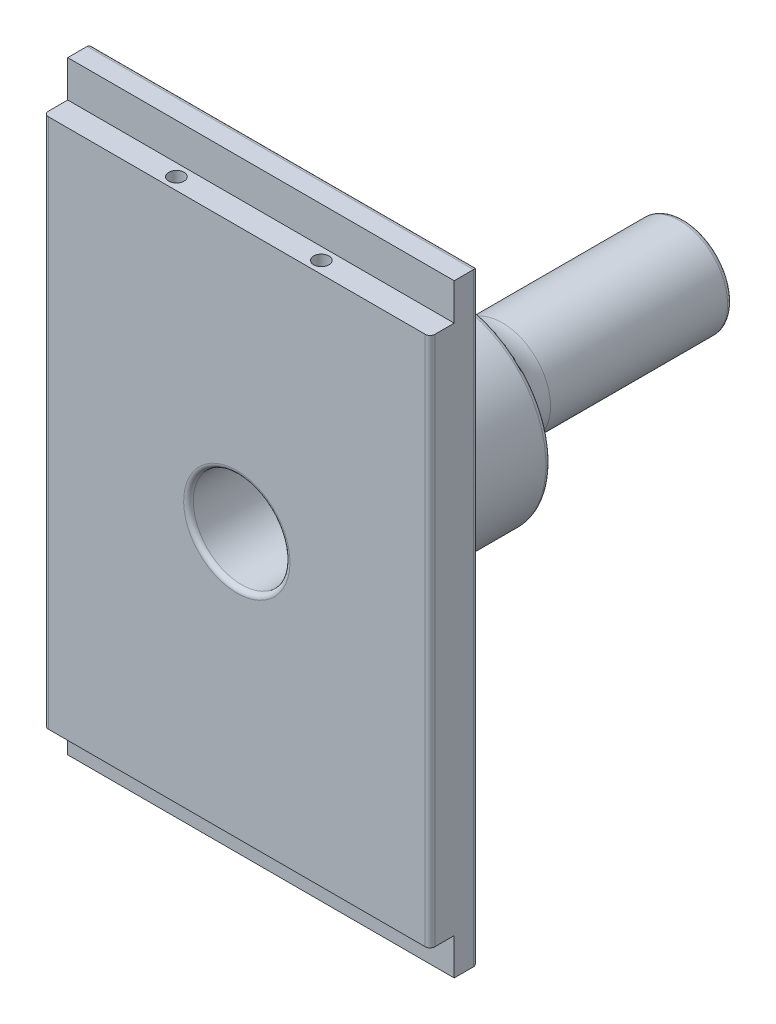
from build123d import *

# Parameters (mm, degrees)
BOSS_EXTRUDE1_DEPTH                  = 50.8
BOSS_EXTRUDE1_DEPTH_BACK             = 50.8
F_10_32_TAPPED_HOLE1_D               = 4.0386
F_10_32_TAPPED_HOLE1_DEPTH           = 25.4
F_10_32_TAPPED_HOLE1_TIP             = 1.213317848
F_10_32_TAPPED_HOLE1_ON_FACE_2_D     = 4.0386
F_10_32_TAPPED_HOLE1_ON_FACE_2_DEPTH = 25.4
F_10_32_TAPPED_HOLE1_ON_FACE_2_TIP   = 1.213317848
SKETCH3_R                            = 25.4
BOSS_EXTRUDE2_DEPTH                  = 44.45
SKETCH4_R                            = 12.7
BOSS_EXTRUDE3_DEPTH                  = 60.452
FILLET1_R                            = 1.27
FILLET2_R                            = 12.7
BODY_MOVE_COPY1_ANGLE                = 90


with BuildPart() as part:
    # Sketch1 → Boss-Extrude1 (new, two sides: drawn at the far end of the back side and taken through both)
    with BuildSketch(Plane(origin=(0, 0, 0), x_dir=(1, 0, 0), z_dir=(0, 1, 0)).offset(-BOSS_EXTRUDE1_DEPTH_BACK)):
        Polygon((0, -50.8), (-79.375, -50.8), (-79.375, -57.15), (-69.723, -57.15), (-69.723, -63.5), (69.723, -63.5), (69.723, -57.15), (79.375, -57.15), (79.375, -50.8), align=None)
    extrude(amount=BOSS_EXTRUDE1_DEPTH + BOSS_EXTRUDE1_DEPTH_BACK)

    # #10-32 Tapped Hole1
    with Locations(Plane(origin=(-69.723, 19.05, 60.325), x_dir=(0, 0, -1), z_dir=(-1, 0, 0))):
        with Locations((0, 0), (0, 38.1)):
            Hole(F_10_32_TAPPED_HOLE1_D / 2, depth=F_10_32_TAPPED_HOLE1_DEPTH)
            with Locations((0, 0, -(F_10_32_TAPPED_HOLE1_DEPTH + F_10_32_TAPPED_HOLE1_TIP / 2))):  # 118° drill point
                Cone(0, F_10_32_TAPPED_HOLE1_D / 2, F_10_32_TAPPED_HOLE1_TIP, mode=Mode.SUBTRACT)

    # #10-32 Tapped Hole1 on face 2
    with Locations(Plane(origin=(69.723, 19.05, 60.325), x_dir=(0, 0, 1), z_dir=(1, 0, 0))):
        with Locations((0, 0), (0, 38.1)):
            Hole(F_10_32_TAPPED_HOLE1_ON_FACE_2_D / 2, depth=F_10_32_TAPPED_HOLE1_ON_FACE_2_DEPTH)
            with Locations((0, 0, -(F_10_32_TAPPED_HOLE1_ON_FACE_2_DEPTH + F_10_32_TAPPED_HOLE1_ON_FACE_2_TIP / 2))):  # 118° drill point
                Cone(0, F_10_32_TAPPED_HOLE1_ON_FACE_2_D / 2, F_10_32_TAPPED_HOLE1_ON_FACE_2_TIP, mode=Mode.SUBTRACT)

    # Sketch3 → Boss-Extrude2 (add)
    with BuildSketch(Plane(origin=(0, 0, 50.8), x_dir=(-1, 0, 0), z_dir=(0, 0, -1))):
        Circle(SKETCH3_R)
    extrude(amount=BOSS_EXTRUDE2_DEPTH)

    # Sketch4 → Boss-Extrude3 (add)
    with BuildSketch(Plane(origin=(0, 0, 6.35), x_dir=(-1, 0, 0), z_dir=(0, 0, -1))):
        Circle(SKETCH4_R)
    extrude(amount=BOSS_EXTRUDE3_DEPTH)

    # Sketch5 → 1/4 (0.25) Diameter Hole1 (revolve, cut)
    with BuildSketch(Plane(origin=(0, 0, -54.102), x_dir=(0, 1, 0), z_dir=(1, 0, 0))):
        Polygon((0, 0), (0, 27.307732465), (3.175, 25.4), (3.175, 0), align=None)
    revolve(axis=Axis((0, 0, -60.452), (0, 0, 1)), mode=Mode.SUBTRACT)

    # Sketch6 → 1 (1) Diameter Hole1 (revolve, cut)
    with BuildSketch(Plane(origin=(0, 0, 63.5), x_dir=(0, -1, 0), z_dir=(1, 0, 0))):
        Polygon((0, 0), (0, 58.430929862), (12.7, 50.8), (12.7, 0), align=None)
    revolve(axis=Axis((0, 0, 69.85), (0, 0, -1)), mode=Mode.SUBTRACT)

    # Fillet1
    fillet1_edges = [part.edges().sort_by_distance(p)[0] for p in [
        (12.7, 0, -54.102),
        (25.4, 0, 6.35),
        (25.4, 0, 50.8),
        (0, 12.7, 63.5),
        (0, -50.8, 63.5),
        (0, -50.8, 50.8),
        (79.375, 0, 50.8),
        (-79.375, 0, 50.8),
        (0, 50.8, 50.8),
        (0, 50.8, 63.5),
    ]]
    fillet(fillet1_edges, radius=FILLET1_R)

    # Fillet2
    fillet2_edges = [part.edges().sort_by_distance(p)[0] for p in [
        (12.7, 0, 6.35),
    ]]
    fillet(fillet2_edges, radius=FILLET2_R)


with BuildPart() as part_1:
    # Body-Move/Copy1: moved
    add(part.part.rotate(Axis((0, 0, 0), (0, 0, 1)), BODY_MOVE_COPY1_ANGLE))


solid = part_1.part
